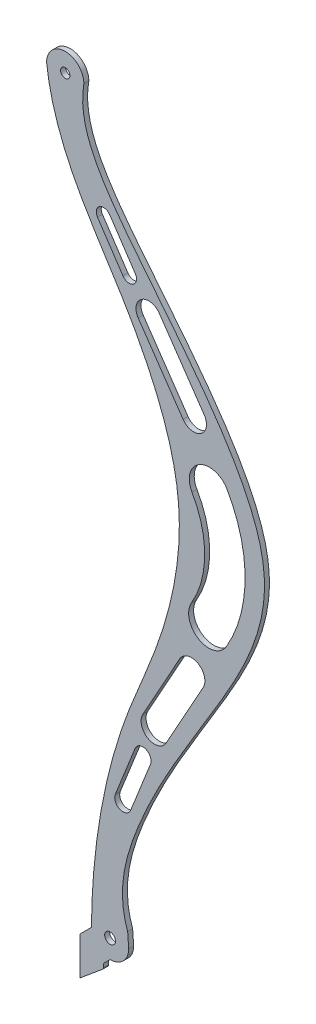
from build123d import *

# Parameters (mm, degrees)
SKETCH2_R           = 1.732831624
SKETCH2_R_2         = 1.5
BOSS_EXTRUDE1_DEPTH = 1.6
FILLET1_R           = 0.9


with BuildPart() as part:
    # Sketch2 → Boss-Extrude1 (new body)
    with BuildSketch(Plane.XY):
        with BuildLine():
            Line((12.36381558, -242.076716149), (14.440531728, -240))
            ThreePointArc((14.440531728, -240), (18.683172415, -238.242640687), (20.440531728, -234))
            Line((20.440531728, -234), (20.376776694, -233.127649323))
            Line((20.376776694, -233.127649323), (20.102586749, -229.375948963))
            add(Edge.make_bspline(
                [(5.760529685, -1.678447518), (4.706168107, -11.302243391), (12.217634734, -25.347438804), (34.199359814, -53.085377705), (65.366773578, -90.301906703), (66.300443832, -122.098297696), (41.723995788, -164.536388316), (24.889665672, -189.788708641), (16.343002308, -219.119804153), (20.102586749, -229.375948963)],
                knots=[0.007063934, 0.007063934, 0.007063934, 0.007063934, 0.129411028, 0.209716388, 0.484272282, 0.700996914, 0.743032739, 0.904630537, 1, 1, 1, 1], degree=3))
            add(Edge.make_bspline(
                [(6, 0), (5.900912673, -0.563337962), (5.821405181, -1.122800041), (5.760529685, -1.678447518)],
                knots=[0, 0, 0, 0, 0.007063934, 0.007063934, 0.007063934, 0.007063934], degree=3))
            ThreePointArc((6, 0), (0, 6), (-6, 0))
            add(Edge.make_bspline(
                [(-6, 0), (-5.947507224, -0.478736658), (-5.88953799, -0.956599626), (-5.826229006, -1.433546502)],
                knots=[0, 0, 0, 0, 0.005833112, 0.005833112, 0.005833112, 0.005833112], degree=3))
            add(Edge.make_bspline(
                [(-5.826229006, -1.433546502), (-4.618474425, -10.532330434), (1.928964748, -28.745336793), (22.583192603, -58.284164555), (41.843243219, -98.733795743), (32.49180138, -140.234054147), (13.549189316, -181.378206446), (8.606428753, -211.799370681), (8.441165108, -233.9128211)],
                knots=[0.005833112, 0.005833112, 0.005833112, 0.005833112, 0.117112228, 0.237052563, 0.446401191, 0.635487594, 0.729133481, 0.999644507, 0.999644507, 0.999644507, 0.999644507], degree=3))
            add(Edge.make_bspline(
                [(8.441165108, -233.9128211), (8.440947927, -233.941881572), (8.4407368, -233.970941207), (8.440531728, -234)],
                knots=[0.999644507, 0.999644507, 0.999644507, 0.999644507, 1, 1, 1, 1], degree=3))
            Line((8.440531728, -234), (4.69307475, -237.747456979))
            Line((4.69307475, -237.747456979), (4.69307475, -250))
            Line((4.69307475, -250), (12.36381558, -243.615321662))
            Line((12.36381558, -243.615321662), (12.36381558, -242.076716149))
        make_face()
        with Locations((14.440531728, -234)):
            Circle(SKETCH2_R, mode=Mode.SUBTRACT)
        with BuildLine():
            ThreePointArc((22.498938935, -177.076225236), (25.95355019, -175.589974713), (27.439800713, -179.044585967))
            Line((27.439800713, -179.044585967), (21.069181187, -195.035735367))
            ThreePointArc((21.069181187, -195.035735367), (17.614569933, -196.521985891), (16.128319409, -193.067374636))
            Line((16.128319409, -193.067374636), (22.498938935, -177.076225236))
        make_face(mode=Mode.SUBTRACT)
        with BuildLine():
            ThreePointArc((36.853945865, -144.924585848), (42.734141403, -143.240646978), (44.418080273, -149.120842516))
            Line((44.418080273, -149.120842516), (32.533504232, -170.543872052))
            ThreePointArc((32.533504232, -170.543872052), (26.653308694, -172.227810921), (24.969369824, -166.347615383))
            Line((24.969369824, -166.347615383), (36.853945865, -144.924585848))
        make_face(mode=Mode.SUBTRACT)
        Circle(SKETCH2_R_2, mode=Mode.SUBTRACT)
        with BuildLine():
            ThreePointArc((22.544281842, -44.665829407), (21.891101421, -47.95818053), (18.598750298, -47.305000109))
            Line((18.598750298, -47.305000109), (10.391049808, -35.034576995))
            ThreePointArc((10.391049808, -35.034576995), (11.044230229, -31.742225872), (14.336581352, -32.395406293))
            Line((14.336581352, -32.395406293), (22.544281842, -44.665829407))
        make_face(mode=Mode.SUBTRACT)
        with BuildLine():
            ThreePointArc((23.502490938, -56.569318152), (24.569058509, -50.841378017), (30.296998644, -51.907945588))
            Line((30.296998644, -51.907945588), (44.746058819, -72.969177952))
            ThreePointArc((44.746058819, -72.969177952), (43.679491248, -78.697118087), (37.951551113, -77.630550516))
            Line((37.951551113, -77.630550516), (23.502490938, -56.569318152))
        make_face(mode=Mode.SUBTRACT)
        with BuildLine():
            ThreePointArc((52.065784517, -89.977573962), (57.91024769, -112.052048287), (51.835025839, -134.064132377))
            ThreePointArc((51.835025839, -134.064132377), (42.929443894, -136.357563202), (40.636013069, -127.451981257))
            ThreePointArc((40.636013069, -127.451981257), (44.905102719, -111.983976517), (40.798168379, -96.472129839))
            ThreePointArc((40.798168379, -96.472129839), (43.18469851, -87.591043831), (52.065784517, -89.977573962))
        make_face(mode=Mode.SUBTRACT)
    extrude(amount=BOSS_EXTRUDE1_DEPTH)

    # Fillet1
    fillet1_edges = [part.edges().sort_by_distance(p)[0] for p in [
        (12.36381558, -243.615321662, 0.8),
    ]]
    fillet(fillet1_edges, radius=FILLET1_R)


solid = part.part
